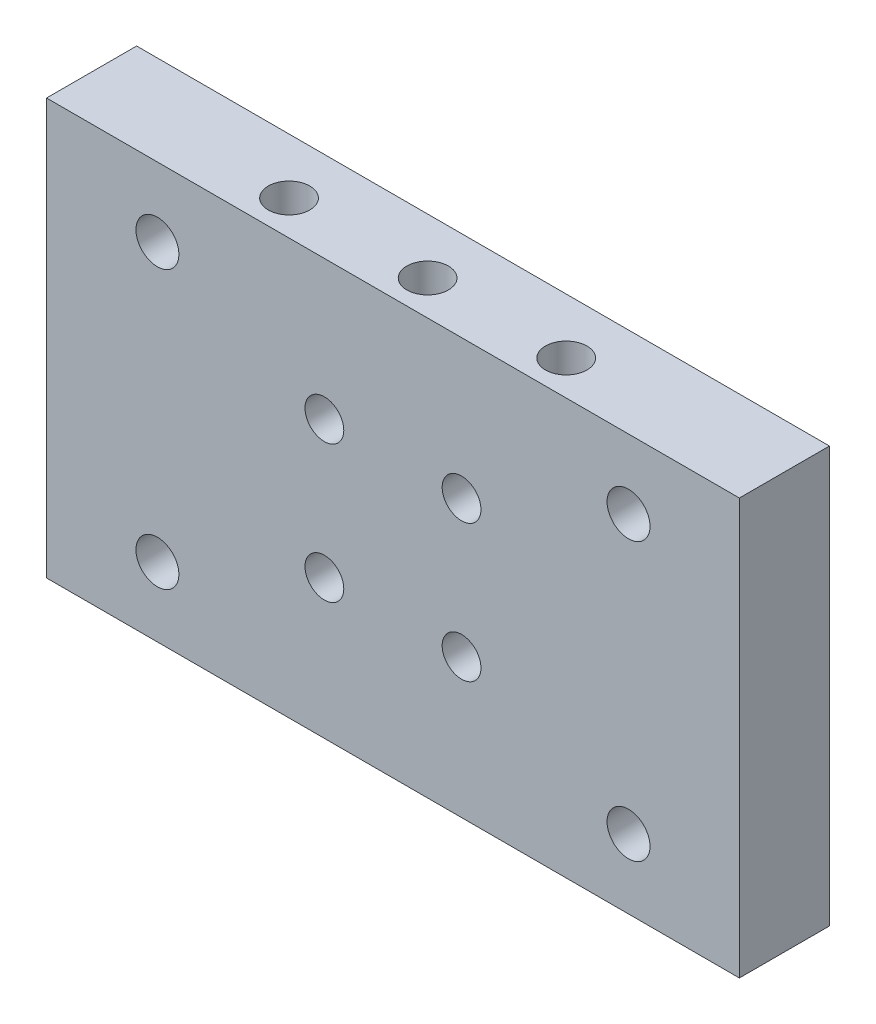
from build123d import *

# Parameters (mm, degrees)
SKETCH_1_W          = 50
SKETCH_1_H          = 30
EXTRUDE_1_DEPTH     = 6.5
CUT_EXTRUDE_1_DEPTH = 30.870554062
SKETCH_4_R          = 1.55
CUT_EXTRUDE_2_DEPTH = 30.870554062
SKETCH_5_R          = 1.5
CUT_EXTRUDE_3_DEPTH = 40.588508434


with BuildPart() as part:
    # 草图1 → 凸台-拉伸1 (new body)
    with BuildSketch(Plane.XY):
        Rectangle(SKETCH_1_W, SKETCH_1_H)
    extrude(amount=EXTRUDE_1_DEPTH)

    # 草图2 → 切除-拉伸1 (cut, through all)
    with BuildSketch(Plane.XY.offset(6.5)):
        with BuildLine():
            ThreePointArc((-3.55, 4.95), (-5.939949494, 5.939949494), (-4.95, 3.55))
            Line((-4.95, 3.55), (-4.95, 4.95))
            Line((-4.95, 4.95), (-3.55, 4.95))
        make_face()
        with BuildLine():
            Line((-4.95, 4.95), (-4.95, 3.55))
            ThreePointArc((-4.95, 3.55), (-3.960050506, 3.960050506), (-3.55, 4.95))
            Line((-3.55, 4.95), (-4.95, 4.95))
        make_face()
        with BuildLine():
            ThreePointArc((3.55, 4.95), (3.960050506, 3.960050506), (4.95, 3.55))
            Line((4.95, 3.55), (4.95, 4.95))
            Line((4.95, 4.95), (3.55, 4.95))
        make_face()
        with BuildLine():
            Line((4.95, 4.95), (4.95, 3.55))
            ThreePointArc((4.95, 3.55), (5.939949494, 3.960050506), (6.35, 4.95))
            ThreePointArc((6.35, 4.95), (4.95, 6.35), (3.55, 4.95))
            Line((3.55, 4.95), (4.95, 4.95))
        make_face()
        with BuildLine():
            ThreePointArc((4.95, -3.55), (3.960050506, -3.960050506), (3.55, -4.95))
            Line((3.55, -4.95), (4.95, -4.95))
            Line((4.95, -4.95), (4.95, -3.55))
        make_face()
        with BuildLine():
            Line((4.95, -4.95), (3.55, -4.95))
            ThreePointArc((3.55, -4.95), (4.95, -6.35), (6.35, -4.95))
            ThreePointArc((6.35, -4.95), (5.939949494, -3.960050506), (4.95, -3.55))
            Line((4.95, -3.55), (4.95, -4.95))
        make_face()
        with BuildLine():
            ThreePointArc((-4.95, -3.55), (-5.939949494, -5.939949494), (-3.55, -4.95))
            Line((-3.55, -4.95), (-4.95, -4.95))
            Line((-4.95, -4.95), (-4.95, -3.55))
        make_face()
        with BuildLine():
            Line((-4.95, -4.95), (-3.55, -4.95))
            ThreePointArc((-3.55, -4.95), (-3.960050506, -3.960050506), (-4.95, -3.55))
            Line((-4.95, -3.55), (-4.95, -4.95))
        make_face()
    extrude(amount=-CUT_EXTRUDE_1_DEPTH, mode=Mode.SUBTRACT)

    # 草图4 → 切除-拉伸2 (cut, through all)
    with BuildSketch(Plane(origin=(0, 0, 0), x_dir=(-1, 0, 0), z_dir=(0, 0, -1))):
        with Locations((-17, 10)):
            Circle(SKETCH_4_R)
        with Locations((-17, -10)):
            Circle(SKETCH_4_R)
        with Locations((17, -10)):
            Circle(SKETCH_4_R)
        with Locations((17, 10)):
            Circle(SKETCH_4_R)
    extrude(amount=-CUT_EXTRUDE_2_DEPTH, mode=Mode.SUBTRACT)

    # 草图5 → 切除-拉伸3 (cut, through all)
    with BuildSketch(Plane(origin=(0, 15, 0), x_dir=(1, 0, 0), z_dir=(0, 1, 0))):
        with Locations(Location((-10, -4, 0), (0, 0, 180))):
            Circle(SKETCH_5_R)
        with Locations(Location((0, -4, 0), (0, 0, 180))):
            Circle(SKETCH_5_R)
        with Locations(Location((10, -4, 0), (0, 0, 180))):
            Circle(SKETCH_5_R)
    extrude(amount=-CUT_EXTRUDE_3_DEPTH, mode=Mode.SUBTRACT)


solid = part.part
